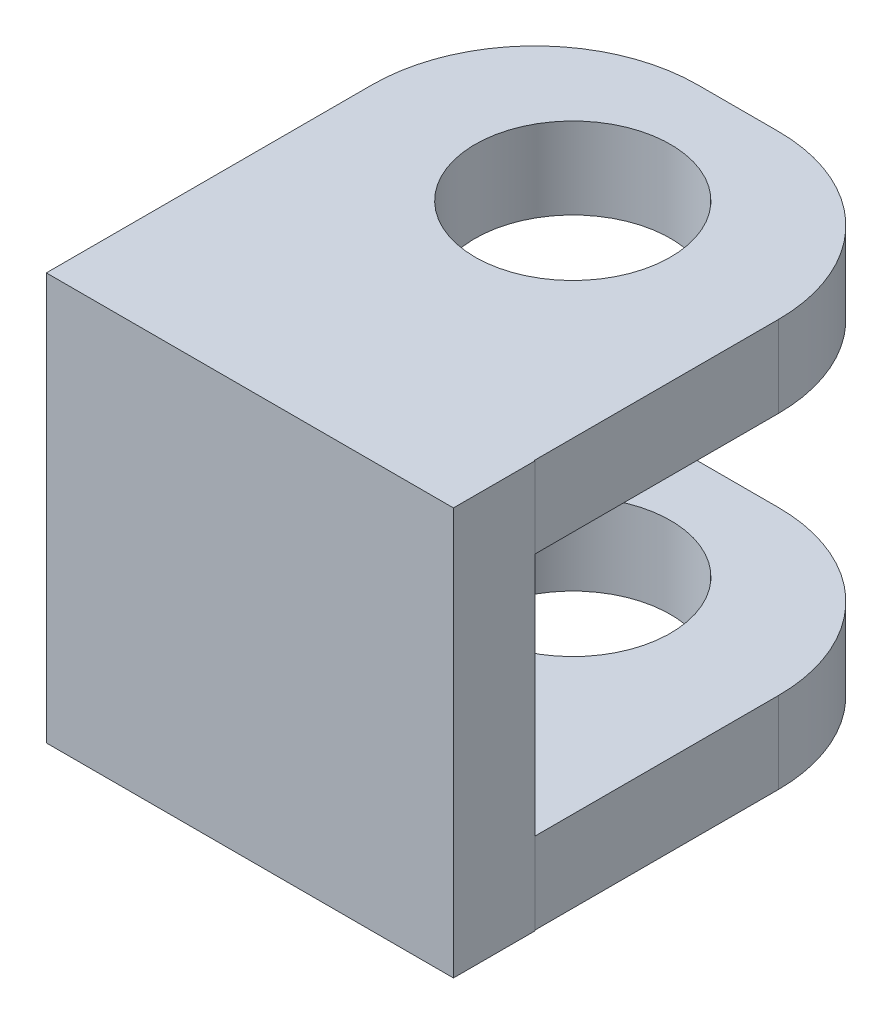
from build123d import *

# Parameters (mm, degrees)
SKETCH1_W           = 50
SKETCH1_H           = 50
BOSS_EXTRUDE1_DEPTH = 10
BOSS_EXTRUDE2_DEPTH = 10
BOSS_EXTRUDE3_START = -10
BOSS_EXTRUDE3_DEPTH = 10
SKETCH4_R           = 12
CUT_EXTRUDE2_DEPTH  = 120


with BuildPart() as part:
    # Sketch1 → Boss-Extrude1 (new body)
    with BuildSketch(Plane.XY):
        with Locations((25, 25)):
            Rectangle(SKETCH1_W, SKETCH1_H)
    extrude(amount=BOSS_EXTRUDE1_DEPTH)

    # Sketch2 → Boss-Extrude2 (add)
    with BuildSketch(Plane(origin=(0, 0, 0), x_dir=(1, 0, 0), z_dir=(0, 1, 0))):
        with BuildLine():
            Line((0, 0), (49.911002168, 0))
            Line((49.911002168, 0), (49.911002168, 30))
            ThreePointArc((49.911002168, 30), (44.053137792, 44.142135624), (29.911002168, 50))
            Line((29.911002168, 50), (20, 50))
            ThreePointArc((20, 50), (5.857864376, 44.142135624), (0, 30))
            Line((0, 30), (0, 0))
        make_face()
    extrude(amount=BOSS_EXTRUDE2_DEPTH)

    # Sketch3 → Boss-Extrude3 (add)
    with BuildSketch(Plane(origin=(0, 50, 0), x_dir=(1, 0, 0), z_dir=(0, 1, 0)).offset(BOSS_EXTRUDE3_START)):
        with BuildLine():
            Line((0, 0), (49.911002168, 0))
            Line((49.911002168, 0), (49.911002168, 30))
            ThreePointArc((49.911002168, 30), (44.053137792, 44.142135624), (29.911002168, 50))
            Line((29.911002168, 50), (20, 50))
            ThreePointArc((20, 50), (5.857864376, 44.142135624), (0, 30))
            Line((0, 30), (0, 0))
        make_face()
    extrude(amount=BOSS_EXTRUDE3_DEPTH)

    # Sketch4 → Cut-Extrude2 (cut)
    with BuildSketch(Plane(origin=(0, 50, 0), x_dir=(1, 0, 0), z_dir=(0, 1, 0))):
        with Locations(Location((24.659042371, 30, 0), (0, 0, 270))):
            Circle(SKETCH4_R)
    extrude(amount=-CUT_EXTRUDE2_DEPTH, mode=Mode.SUBTRACT)


solid = part.part
